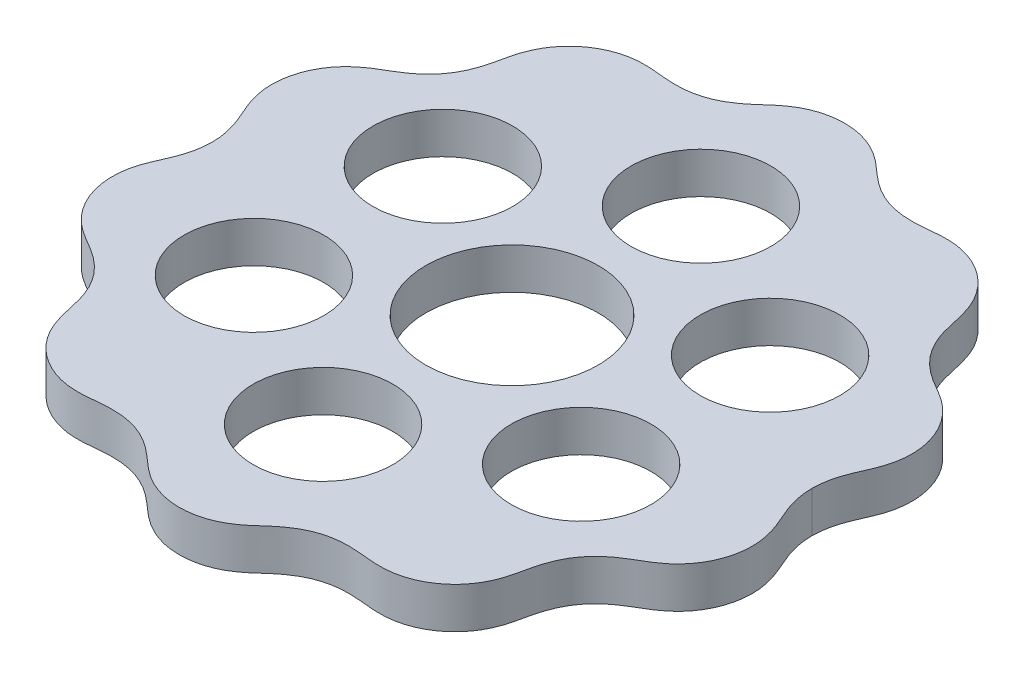
from build123d import *

# Parameters (mm, degrees)
SKETCH1_R           = 10.5
SKETCH1_R_2         = 8.5
BOSS_EXTRUDE1_DEPTH = 5


with BuildPart() as part:
    # Sketch1 → Boss-Extrude1 (new body)
    with BuildSketch(Plane(origin=(0, 0, 0), x_dir=(1, 0, 0), z_dir=(0, 1, 0))):
        with BuildLine():
            add(Edge.make_bspline(
                [(36.5, 0), (36.5, -0.048499306), (36.500946474, -0.144120136), (36.505205639, -0.349195994), (36.516548144, -0.571582738), (36.53776893, -0.854430115), (36.574407998, -1.196752003), (36.62809738, -1.556988295), (36.70127876, -1.938208043), (36.78047365, -2.281954505), (36.861329003, -2.590026625), (36.973593296, -2.971756615), (37.124850001, -3.424875263), (37.335057521, -3.978884819), (37.610804689, -4.630454515), (37.912979272, -5.308786828), (38.217993537, -6.024773331), (38.579337976, -7.000673113), (38.903566381, -8.266221267), (39.040360932, -9.835827251), (38.833195825, -11.619336074), (38.300146641, -13.287501244), (37.486961222, -14.788321278), (36.519443961, -15.985374972), (35.463247749, -16.921686084), (34.480633006, -17.584395869), (33.651986164, -18.070393448), (32.741397785, -18.599880286), (31.745814237, -19.23037768), (30.644081106, -20.103969947), (29.551914438, -21.316953149), (28.709876259, -22.688378726), (28.129188952, -24.127329092), (27.764036764, -25.53676255), (27.498568237, -26.872010136), (27.14459296, -28.24566423), (26.585858616, -29.613191611), (25.753833767, -30.946724523), (24.630275661, -32.173887031), (23.304067671, -33.178476098), (21.818707229, -33.928039056), (20.354428633, -34.356223626), (18.980021188, -34.522492919), (17.810145148, -34.508679014), (16.856619883, -34.426627197), (15.978233576, -34.333926374), (15.170927755, -34.265741371), (14.149802015, -34.229580128), (12.916311546, -34.297819178), (11.49268827, -34.581382628), (10.018707632, -35.167894044), (8.730716825, -35.94686999), (7.616704888, -36.833430943), (6.627661642, -37.741061624), (5.549118095, -38.667467053), (4.288853719, -39.488783224), (2.83273482, -40.115486753), (1.209906645, -40.482844808), (-0.452411505, -40.551448925), (-2.099959875, -40.319988007), (-3.516029788, -39.847376882), (-4.684831629, -39.236604984), (-5.595122009, -38.603332332), (-6.291293195, -38.03136891), (-6.935196982, -37.455611034), (-7.552937159, -36.905280935), (-8.3720822, -36.227490452), (-9.417339699, -35.501645102), (-10.744745036, -34.835364198), (-12.274940897, -34.396213159), (-13.568324156, -34.246071291), (-14.609253635, -34.240736665), (-15.418369646, -34.285553755), (-16.096609715, -34.346726816), (-16.983957337, -34.439047454), (-18.129700574, -34.534198807), (-19.514247662, -34.499663354), (-21.100124923, -34.177722278), (-22.642688121, -33.554292595), (-24.047237509, -32.662289917), (-25.268485598, -31.532537595), (-26.154336533, -30.347709032), (-26.756076077, -29.20476342), (-27.137211283, -28.192212286), (-27.376331213, -27.351346043), (-27.564158904, -26.521994318), (-27.736255611, -25.71290243), (-27.9936462, -24.634267957), (-28.399117079, -23.379440462), (-29.076792687, -22.004837755), (-30.054056647, -20.718767709), (-31.078771932, -19.746027017), (-32.039482, -19.04146275), (-32.864050638, -18.52796692), (-33.790814113, -17.989908183), (-34.820371489, -17.38242567), (-35.961313043, -16.537601472), (-37.086556652, -15.342606474), (-37.986548491, -13.943319085), (-38.618524242, -12.404128407), (-38.963667013, -10.776717844), (-39.002753109, -9.320975979), (-38.844934454, -8.085734909), (-38.592561063, -7.081267912), (-38.326228914, -6.296968631), (-38.011335485, -5.531557624), (-37.674927383, -4.77594876), (-37.378377228, -4.087797522), (-37.136778411, -3.461265107), (-36.948914251, -2.898248212), (-36.825242681, -2.464456921), (-36.734418474, -2.088562143), (-36.661575892, -1.734972023), (-36.604229284, -1.403741901), (-36.561095025, -1.084527578), (-36.530996656, -0.773408388), (-36.51357757, -0.520248866), (-36.504270411, -0.30979969), (-36.50077644, -0.13220069), (-36.5, -0.043927313), (-36.5, 0)],
                knots=[0.075291946, 0.075291946, 0.075291946, 0.075291946, 0.075291946, 0.076789614, 0.078287282, 0.07978495, 0.081282618, 0.084277954, 0.08727329, 0.089360772, 0.091448255, 0.093535738, 0.09562322, 0.099798186, 0.103973151, 0.109075131, 0.11417711, 0.11927909, 0.12438107, 0.136358468, 0.148336576, 0.160314307, 0.171165011, 0.182015901, 0.19286658, 0.200455433, 0.208044287, 0.213054353, 0.21806442, 0.228084552, 0.238937008, 0.249793369, 0.260645765, 0.270063658, 0.279481551, 0.287924265, 0.29636698, 0.307216588, 0.31806735, 0.328918293, 0.339769011, 0.350619262, 0.361470141, 0.368707076, 0.375944011, 0.381255238, 0.386566466, 0.391877694, 0.397188922, 0.408043704, 0.418896938, 0.42975045, 0.43856656, 0.447382671, 0.456176825, 0.464970979, 0.475821103, 0.486671615, 0.497522231, 0.508373237, 0.519223851, 0.530073652, 0.536457884, 0.542842116, 0.54826674, 0.553691365, 0.55911599, 0.564540614, 0.576145954, 0.586999876, 0.597853142, 0.606065959, 0.610172367, 0.614278775, 0.619102733, 0.62392669, 0.633574604, 0.644425041, 0.655275871, 0.666126278, 0.676977072, 0.687828191, 0.698678662, 0.70471008, 0.710741499, 0.716165428, 0.721589356, 0.727013285, 0.732437214, 0.745249936, 0.756104619, 0.766960924, 0.774569677, 0.78217843, 0.787303815, 0.7924292, 0.802679969, 0.813530568, 0.824380707, 0.835231117, 0.846082101, 0.856932921, 0.867783145, 0.873212041, 0.878640937, 0.884065114, 0.889489291, 0.894913468, 0.900337645, 0.90371728, 0.907096914, 0.910476548, 0.912166365, 0.913856182, 0.91656915, 0.919282118, 0.920638602, 0.921995086, 0.92335157, 0.924708054, 0.924708054, 0.924708054, 0.924708054, 0.924708054], degree=4))
            add(Edge.make_bspline(
                [(-36.5, 0), (-36.5, 0.048499305), (-36.500709854, 0.120347377), (-36.503076032, 0.248821581), (-36.509459135, 0.430805007), (-36.518670462, 0.600909868), (-36.537767816, 0.853780444), (-36.574410609, 1.197161726), (-36.628092737, 1.556776711), (-36.70128534, 1.938275134), (-36.798317842, 2.359473017), (-36.924362877, 2.820443145), (-37.096624147, 3.350360221), (-37.335050856, 3.978935622), (-37.610808448, 4.630425207), (-37.912977339, 5.30880264), (-38.217994227, 6.024766679), (-38.579337761, 7.000676775), (-38.903566296, 8.266218611), (-39.040361318, 9.835829449), (-38.83319516, 11.619334121), (-38.300147751, 13.287503552), (-37.486959297, 14.788317854), (-36.51944727, 15.985380477), (-35.463241983, 16.921676737), (-34.480643682, 17.584412987), (-33.651966589, 18.070362205), (-32.906545987, 18.503912569), (-32.256987734, 18.906587709), (-31.445352143, 19.468675663), (-30.515561037, 20.246660688), (-29.551926436, 21.316972253), (-28.709868851, 22.688366931), (-28.129194123, 24.127337321), (-27.764033611, 25.53675754), (-27.498569959, 26.872012871), (-27.144592106, 28.24566287), (-26.585859124, 29.613192421), (-25.753833457, 30.946724029), (-24.630275847, 32.173887326), (-23.304067555, 33.178475912), (-21.818707307, 33.928039181), (-20.354428582, 34.356223545), (-18.980021222, 34.522492971), (-17.810145124, 34.508678977), (-16.856619896, 34.426627224), (-15.978233572, 34.333926353), (-15.170927757, 34.265741379), (-14.149802015, 34.229580123), (-12.916311545, 34.29781918), (-11.492688271, 34.581382626), (-10.018707631, 35.167894044), (-8.730716827, 35.94686999), (-7.616704884, 36.833430941), (-6.627661644, 37.741061623), (-5.549118097, 38.667467054), (-4.288853718, 39.488783222), (-2.832734821, 40.115486753), (-1.209906645, 40.482844807), (0.452411504, 40.551448925), (2.099959876, 40.319988007), (3.516029787, 39.847376881), (4.68483163, 39.236604984), (5.595122006, 38.60333233), (6.291293204, 38.031368915), (6.935196973, 37.455611027), (7.552937162, 36.905280937), (8.372082197, 36.227490449), (9.417339701, 35.501645103), (10.744745035, 34.835364195), (12.274940897, 34.396213161), (13.568324156, 34.246071287), (14.609253634, 34.240736671), (15.418369647, 34.285553746), (16.096609716, 34.346726821), (16.983957335, 34.439047449), (18.129700573, 34.534198813), (19.514247663, 34.499663349), (21.100124923, 34.17772228), (22.642688121, 33.554292593), (24.047237508, 32.662289917), (25.268485599, 31.532537594), (26.154336531, 30.347709032), (26.756076079, 29.204763419), (27.137211278, 28.192212287), (27.376331225, 27.351346041), (27.564158894, 26.521994319), (27.736255613, 25.712902429), (27.993646196, 24.634267958), (28.399117082, 23.37944046), (29.076792686, 22.004837756), (30.054056648, 20.718767707), (31.078771932, 19.74602702), (32.039481999, 19.041462745), (32.864050639, 18.527966924), (33.790814111, 17.98990817), (34.82037149, 17.382425694), (35.961313043, 16.537601441), (37.086556651, 15.342606512), (37.986548494, 13.94331903), (38.618524236, 12.404128495), (38.963667022, 10.77671769), (39.002753094, 9.320976227), (38.844934477, 8.085734521), (38.592561023, 7.081268579), (38.32622901, 6.296967044), (38.011335306, 5.531560737), (37.674927708, 4.775943023), (37.37837668, 4.087807125), (37.136779297, 3.461249479), (36.969310994, 2.959402658), (36.860578901, 2.58836954), (36.779829118, 2.276540793), (36.721424729, 2.02544297), (36.661575157, 1.735036695), (36.604229765, 1.403615039), (36.561094779, 1.084737296), (36.530996745, 0.773135873), (36.515319468, 0.545818588), (36.507760589, 0.388500267), (36.502523425, 0.222042212), (36.500582329, 0.109223844), (36.5, 0.043927313), (36.5, 0)],
                knots=[0.075291946, 0.075291946, 0.075291946, 0.075291946, 0.075291946, 0.076789614, 0.077538448, 0.078287282, 0.07978495, 0.081282618, 0.084277954, 0.08727329, 0.089360772, 0.091448255, 0.09562322, 0.099798186, 0.103973151, 0.109075131, 0.11417711, 0.11927909, 0.12438107, 0.136358468, 0.148336576, 0.160314307, 0.171165011, 0.182015901, 0.19286658, 0.200455433, 0.208044287, 0.213054353, 0.21806442, 0.223074486, 0.228084552, 0.238937008, 0.249793369, 0.260645765, 0.270063658, 0.279481551, 0.287924265, 0.29636698, 0.307216588, 0.31806735, 0.328918293, 0.339769011, 0.350619262, 0.361470141, 0.368707076, 0.375944011, 0.381255238, 0.386566466, 0.391877694, 0.397188922, 0.408043704, 0.418896938, 0.42975045, 0.43856656, 0.447382671, 0.456176825, 0.464970979, 0.475821103, 0.486671615, 0.497522231, 0.508373237, 0.519223851, 0.530073652, 0.536457884, 0.542842116, 0.54826674, 0.553691365, 0.55911599, 0.564540614, 0.576145954, 0.586999876, 0.597853142, 0.606065959, 0.610172367, 0.614278775, 0.619102733, 0.62392669, 0.633574604, 0.644425041, 0.655275871, 0.666126278, 0.676977072, 0.687828191, 0.698678662, 0.70471008, 0.710741499, 0.716165428, 0.721589356, 0.727013285, 0.732437214, 0.745249936, 0.756104619, 0.766960924, 0.774569677, 0.78217843, 0.787303815, 0.7924292, 0.802679969, 0.813530568, 0.824380707, 0.835231117, 0.846082101, 0.856932921, 0.867783145, 0.873212041, 0.878640937, 0.884065114, 0.889489291, 0.894913468, 0.900337645, 0.90371728, 0.907096914, 0.908786731, 0.910476548, 0.912166365, 0.913856182, 0.91656915, 0.919282118, 0.920638602, 0.921995086, 0.922673328, 0.92335157, 0.924708054, 0.924708054, 0.924708054, 0.924708054, 0.924708054], degree=4))
        make_face()
        with Locations(Location((0, 0, 0), (0, 0, 270))):
            Circle(SKETCH1_R, mode=Mode.SUBTRACT)
        with Locations(Location((0, 23, 0), (0, 0, 270))):
            Circle(SKETCH1_R_2, mode=Mode.SUBTRACT)
        with Locations(Location((19.918584287, 11.5, 0), (0, 0, 270))):
            Circle(SKETCH1_R_2, mode=Mode.SUBTRACT)
        with Locations(Location((19.918584287, -11.5, 0), (0, 0, 270))):
            Circle(SKETCH1_R_2, mode=Mode.SUBTRACT)
        with Locations(Location((0, -23, 0), (0, 0, 270))):
            Circle(SKETCH1_R_2, mode=Mode.SUBTRACT)
        with Locations(Location((-19.918584287, -11.5, 0), (0, 0, 270))):
            Circle(SKETCH1_R_2, mode=Mode.SUBTRACT)
        with Locations(Location((-19.918584287, 11.5, 0), (0, 0, 270))):
            Circle(SKETCH1_R_2, mode=Mode.SUBTRACT)
    extrude(amount=BOSS_EXTRUDE1_DEPTH)


solid = part.part
